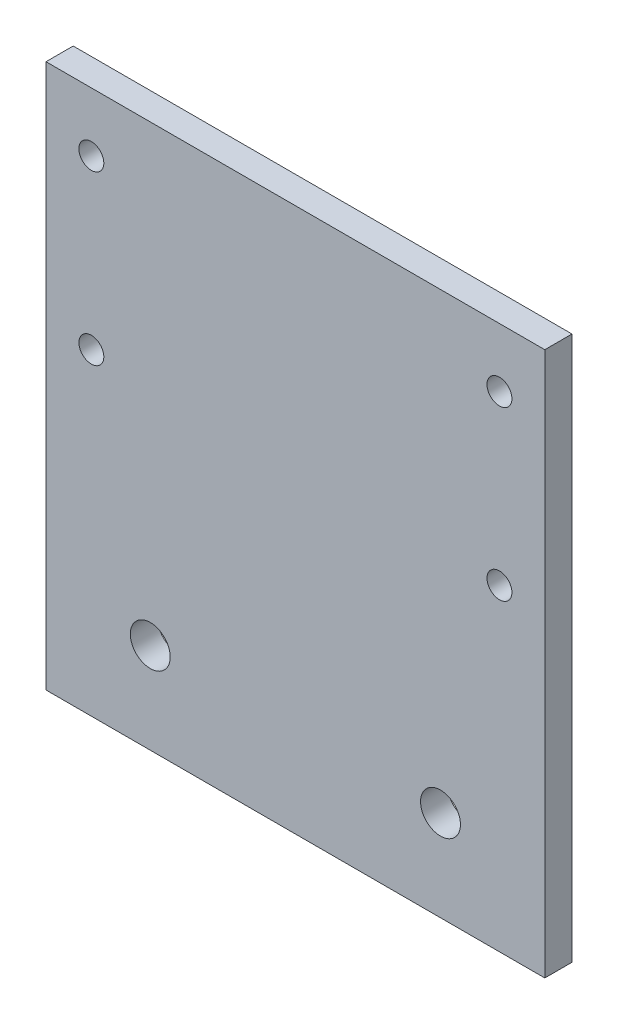
from build123d import *

# Parameters (mm, degrees)
SKETCH1_W           = 55
SKETCH1_H           = 60
SKETCH1_R           = 1.375
SKETCH1_R_2         = 2.2
BOSS_EXTRUDE1_DEPTH = 3


with BuildPart() as part:
    # Sketch1 → Boss-Extrude1 (new body)
    with BuildSketch(Plane.XY):
        with Locations((27.5, 30)):
            Rectangle(SKETCH1_W, SKETCH1_H)
        with Locations((5, 53.5)):
            Circle(SKETCH1_R, mode=Mode.SUBTRACT)
        with Locations((50, 53.5)):
            Circle(SKETCH1_R, mode=Mode.SUBTRACT)
        with Locations((50, 35)):
            Circle(SKETCH1_R, mode=Mode.SUBTRACT)
        with Locations((5, 35)):
            Circle(SKETCH1_R, mode=Mode.SUBTRACT)
        with Locations((11.5, 10)):
            Circle(SKETCH1_R_2, mode=Mode.SUBTRACT)
        with Locations((43.5, 10)):
            Circle(SKETCH1_R_2, mode=Mode.SUBTRACT)
    extrude(amount=BOSS_EXTRUDE1_DEPTH)


solid = part.part
